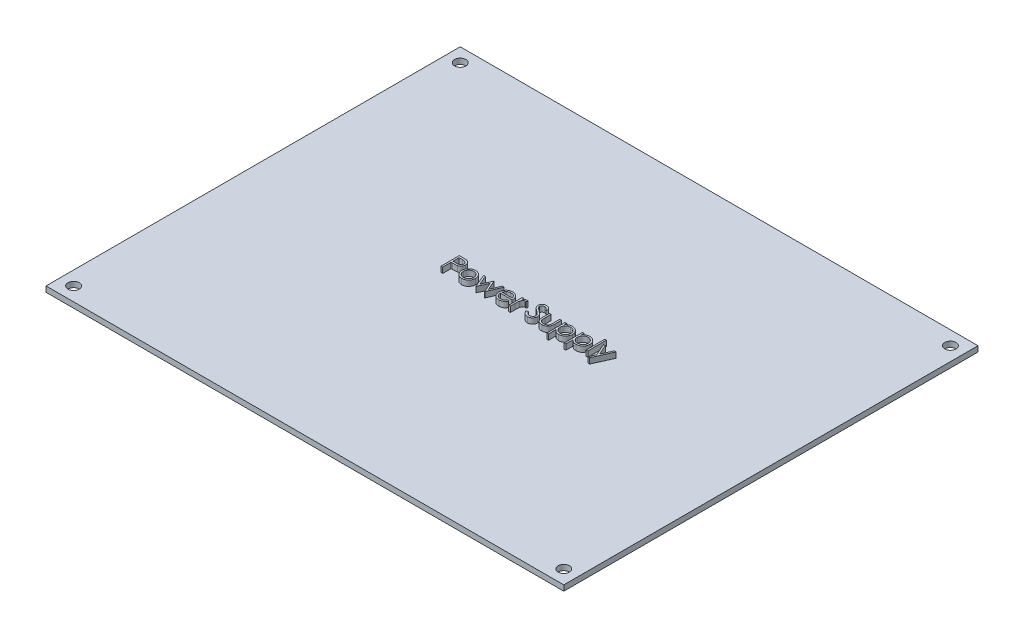
from build123d import *

# Parameters (mm, degrees)
SKETCH1_W             = 150
SKETCH1_H             = 120
BOSS_EXTRUDE1_DEPTH   = 1.6
F_4_CLEARANCE_HOLE2_D = 3.2639
SKETCH6_W             = 0.474893162
SKETCH6_H             = 5.427350427
BOSS_EXTRUDE2_DEPTH   = 1.6


with BuildPart() as part:
    # Sketch1 → Boss-Extrude1 (new body)
    with BuildSketch(Plane(origin=(0, 0, 0), x_dir=(1, 0, 0), z_dir=(0, 1, 0))):
        Rectangle(SKETCH1_W, SKETCH1_H)
    extrude(amount=BOSS_EXTRUDE1_DEPTH)

    # #4 Clearance Hole2 (through all)
    with Locations(Plane(origin=(0, 1.6, 0), x_dir=(1, 0, 0), z_dir=(0, 1, 0))):
        with Locations((-71, 56), (71, 56), (71, -56), (-71, -56)):
            Hole(F_4_CLEARANCE_HOLE2_D / 2)

    # Sketch6 → Boss-Extrude2 (add)
    # profile 1 of 11: a face of its own
    with BuildSketch(Plane(origin=(0, 1.6, 0), x_dir=(1, 0, 0), z_dir=(0, 1, 0))):
        with BuildLine():
            Line((-21.139712954, 5.867840544), (-20.101944191, 5.867840544))
            add(Edge.make_bspline(
                [(-20.101944191, 5.867840544), (-20.030565797, 5.867762082), (-19.893801625, 5.867611745), (-19.697684814, 5.863053737), (-19.51956772, 5.856965762), (-19.359834406, 5.848526471), (-19.2179934, 5.838553055), (-19.094686531, 5.824564852), (-18.988944583, 5.809959405), (-18.925586022, 5.795110374), (-18.896690785, 5.788338341)],
                knots=[0, 0, 0, 0, 1.415646017, 2.712440637, 3.8905458, 4.950247383, 5.884950622, 6.709939814, 7.411656543, 8, 8, 8, 8], degree=3))
            add(Edge.make_bspline(
                [(-18.896690785, 5.788338341), (-18.860112466, 5.778326583), (-18.787817751, 5.758538983), (-18.683645936, 5.71890633), (-18.584534765, 5.671913056), (-18.490144194, 5.618355433), (-18.40163414, 5.555935592), (-18.317684054, 5.487183812), (-18.239034798, 5.41051275), (-18.166128646, 5.326782346), (-18.09917425, 5.237398219), (-18.041525801, 5.141026038), (-17.993254874, 5.039287996), (-17.951853976, 4.932254859), (-17.92205667, 4.819027822), (-17.899609571, 4.700393626), (-17.885361944, 4.576364987), (-17.883997356, 4.491607807), (-17.883302698, 4.448461204)],
                knots=[0, 0, 0, 0, 0.999701418, 1.975846123, 2.934577507, 3.890451536, 4.834027766, 5.787354733, 6.749476667, 7.726910423, 8.712836071, 9.690891519, 10.682875813, 11.679750201, 12.712814741, 13.765529915, 14.8625177, 16, 16, 16, 16], degree=3))
            add(Edge.make_bspline(
                [(-17.883302698, 4.448461204), (-17.883939852, 4.404951946), (-17.885186487, 4.319823145), (-17.900148728, 4.195283334), (-17.920302708, 4.076268625), (-17.951292299, 3.963042908), (-17.9918804, 3.856278589), (-18.039493385, 3.754344107), (-18.096920865, 3.658973651), (-18.162907691, 3.569820985), (-18.236313078, 3.486802427), (-18.316826448, 3.410519583), (-18.40412276, 3.341418976), (-18.497924579, 3.279345695), (-18.599146374, 3.225739177), (-18.706252963, 3.177725156), (-18.820175314, 3.137401053), (-18.89900983, 3.116188936), (-18.939091961, 3.105403979)],
                knots=[0, 0, 0, 0, 1.121902311, 2.195077645, 3.232258892, 4.234102512, 5.217864754, 6.176164875, 7.132989551, 8.084763148, 9.034132444, 9.988522005, 10.94243251, 11.903244335, 12.886203696, 13.894208494, 14.929344452, 16, 16, 16, 16], degree=3))
            add(Edge.make_bspline(
                [(-18.939091961, 3.105403979), (-18.972244001, 3.098353996), (-19.044898626, 3.082903548), (-19.164554885, 3.065655047), (-19.303869932, 3.050932722), (-19.462653617, 3.039894098), (-19.640763414, 3.030444136), (-19.838295672, 3.022932851), (-20.055638146, 3.018805572), (-20.207238717, 3.018592707), (-20.286389303, 3.01848157)],
                knots=[0, 0, 0, 0, 0.601384939, 1.31797006, 2.144135048, 3.087295005, 4.142315834, 5.309527816, 6.595305764, 8, 8, 8, 8], degree=3))
            Line((-20.286389303, 3.01848157), (-20.664819792, 3.01848157))
            Line((-20.664819792, 3.01848157), (-20.664819792, 0.576173878))
            Line((-20.664819792, 0.576173878), (-21.139712954, 0.576173878))
            Line((-21.139712954, 0.576173878), (-21.139712954, 5.867840544))
        make_face()
        with BuildLine():
            Line((-20.664819792, 5.325105502), (-20.664819792, 3.561216613))
            Line((-20.664819792, 3.561216613), (-19.738354113, 3.54955629))
            add(Edge.make_bspline(
                [(-19.738354113, 3.54955629), (-19.693118035, 3.54953291), (-19.605790718, 3.549487776), (-19.479643095, 3.555513055), (-19.362607625, 3.562468622), (-19.255043803, 3.572652697), (-19.15690314, 3.587047931), (-19.068021995, 3.601579964), (-18.989089556, 3.622603548), (-18.896713381, 3.650911045), (-18.793777844, 3.699190119), (-18.681794765, 3.769266738), (-18.586891616, 3.858591142), (-18.504767525, 3.959023697), (-18.439595543, 4.070752142), (-18.391885888, 4.190296844), (-18.363853424, 4.316431807), (-18.360094536, 4.402743636), (-18.35819586, 4.446341145)],
                knots=[0, 0, 0, 0, 1.160613943, 2.240541288, 3.23993089, 4.169200891, 5.011653406, 5.7853311, 6.478053781, 7.106038997, 8.262395093, 9.384106736, 10.481365981, 11.59014053, 12.70357646, 13.786202915, 14.881775077, 16, 16, 16, 16], degree=3))
            add(Edge.make_bspline(
                [(-18.35819586, 4.446341145), (-18.360104861, 4.488883898), (-18.36389972, 4.573453624), (-18.392105608, 4.697397703), (-18.439502785, 4.815682637), (-18.505205017, 4.926010992), (-18.584944583, 5.02608216), (-18.677623351, 5.11301234), (-18.783023163, 5.182895153), (-18.881067512, 5.228000233), (-18.96815502, 5.255539995), (-19.043798578, 5.27480898), (-19.129207098, 5.290193527), (-19.224408384, 5.302650871), (-19.328664549, 5.313315033), (-19.442871287, 5.320550974), (-19.566595962, 5.324786509), (-19.652488135, 5.324996597), (-19.697012968, 5.325105502)],
                knots=[0, 0, 0, 0, 1.120700087, 2.227813068, 3.331159281, 4.466773991, 5.599788987, 6.693661531, 7.80175334, 8.91857717, 9.525282508, 10.207424825, 10.974604443, 11.810962634, 12.737642355, 13.736264703, 14.826523623, 16, 16, 16, 16], degree=3))
            Line((-19.697012968, 5.325105502), (-20.664819792, 5.325105502))
        make_face(mode=Mode.SUBTRACT)
    # profile 2 of 11: a face of its own
    with BuildSketch(Plane(origin=(0, 1.6, 0), x_dir=(1, 0, 0), z_dir=(0, 1, 0))):
        with BuildLine():
            add(Edge.make_bspline(
                [(-15.065744605, 4.511002937), (-14.993186371, 4.509457935), (-14.850917406, 4.506428564), (-14.642565008, 4.474051175), (-14.44368129, 4.424540279), (-14.253504547, 4.356093989), (-14.074470386, 4.264348659), (-13.903971005, 4.154872707), (-13.742473861, 4.025177595), (-13.645677138, 3.924850516), (-13.596543884, 3.87392528)],
                knots=[0, 0, 0, 0, 1.054011418, 2.066658804, 3.057071809, 4.030435133, 4.997543892, 5.974964718, 6.972108034, 8, 8, 8, 8], degree=3))
            add(Edge.make_bspline(
                [(-13.596543884, 3.87392528), (-13.554237834, 3.825220801), (-13.470444473, 3.72875441), (-13.362999875, 3.572339376), (-13.270438706, 3.410353748), (-13.196260182, 3.24064648), (-13.137772111, 3.064699061), (-13.096246594, 2.881906734), (-13.071546704, 2.692673186), (-13.068216028, 2.564155478), (-13.066529193, 2.499067174)],
                knots=[0, 0, 0, 0, 1.025258237, 2.030674902, 3.01204498, 3.988269485, 4.97094183, 5.956517959, 6.965070386, 8, 8, 8, 8], degree=3))
            add(Edge.make_bspline(
                [(-13.066529193, 2.499067174), (-13.068012882, 2.43360161), (-13.07094472, 2.304238604), (-13.098678521, 2.113709325), (-13.141814805, 1.92896239), (-13.203548656, 1.75077127), (-13.282709131, 1.578591281), (-13.379305765, 1.413174462), (-13.494016425, 1.254194451), (-13.624046277, 1.103001196), (-13.767755661, 0.963654657), (-13.923657457, 0.842205964), (-14.08868796, 0.738154373), (-14.265041601, 0.654339792), (-14.451107921, 0.588254888), (-14.64728825, 0.541839387), (-14.853277821, 0.513775889), (-14.99392612, 0.510172154), (-15.065744605, 0.508331997)],
                knots=[0, 0, 0, 0, 0.998656419, 1.973391657, 2.932242238, 3.890759089, 4.846373663, 5.82037756, 6.809684879, 7.83454468, 8.860553229, 9.859544525, 10.845671541, 11.83227036, 12.833544569, 13.85385346, 14.904124723, 16, 16, 16, 16], degree=3))
            add(Edge.make_bspline(
                [(-15.065744605, 0.508331997), (-15.137914955, 0.51017833), (-15.279264231, 0.513794465), (-15.485980894, 0.541730357), (-15.682512818, 0.588233497), (-15.868822722, 0.654556968), (-16.045934574, 0.738157052), (-16.211921302, 0.841891392), (-16.367949746, 0.963690675), (-16.511689532, 1.102991437), (-16.641711233, 1.254196966), (-16.756423995, 1.41317381), (-16.853020083, 1.578591451), (-16.932180701, 1.750771225), (-16.993914514, 1.928962403), (-17.037050809, 2.113709321), (-17.064784607, 2.304238605), (-17.067716445, 2.433601611), (-17.069200134, 2.499067174)],
                knots=[0, 0, 0, 0, 1.099876186, 2.154163076, 3.173186993, 4.173200201, 5.163417411, 6.152872554, 7.150605724, 8.17532212, 9.198891216, 10.186952605, 11.159729845, 12.11414092, 13.071450619, 14.029093627, 15.002601286, 16, 16, 16, 16], degree=3))
            add(Edge.make_bspline(
                [(-17.069200134, 2.499067174), (-17.067501795, 2.563801713), (-17.064139377, 2.691964976), (-17.039464322, 2.880842794), (-16.99810079, 3.063325752), (-16.939542608, 3.238594031), (-16.864680355, 3.407557607), (-16.773419836, 3.569943482), (-16.664879237, 3.725651228), (-16.581419143, 3.821992944), (-16.539185443, 3.870745192)],
                knots=[0, 0, 0, 0, 1.031353054, 2.041901799, 3.029428768, 4.008703097, 4.981709435, 5.96992636, 6.972712378, 8, 8, 8, 8], degree=3))
            add(Edge.make_bspline(
                [(-16.539185443, 3.870745192), (-16.490126264, 3.922112064), (-16.393642756, 4.023134057), (-16.231341703, 4.152451088), (-16.061261759, 4.264205152), (-15.880249073, 4.354127525), (-15.690228562, 4.424942903), (-15.49032566, 4.474178861), (-15.281266249, 4.506311909), (-15.138301108, 4.509423678), (-15.065744605, 4.511002937)],
                knots=[0, 0, 0, 0, 1.027980169, 2.021703884, 2.998553061, 3.971491411, 4.943284454, 5.930300938, 6.949603206, 8, 8, 8, 8], degree=3))
        make_face()
        with BuildLine():
            add(Edge.make_bspline(
                [(-15.067864664, 4.036109775), (-15.1191751, 4.034651404), (-15.220471401, 4.03177231), (-15.369574821, 4.009874026), (-15.513115292, 3.975179585), (-15.65136514, 3.925885357), (-15.78385815, 3.862235832), (-15.910721175, 3.784057716), (-16.032327364, 3.69238646), (-16.146297865, 3.587365516), (-16.250894932, 3.472643703), (-16.342331873, 3.350408684), (-16.420081736, 3.222643137), (-16.484851976, 3.089214198), (-16.533092606, 2.948769716), (-16.568128009, 2.80290019), (-16.590005635, 2.651308429), (-16.592857659, 2.548255461), (-16.594306971, 2.495887085)],
                knots=[0, 0, 0, 0, 1.021534396, 2.016698045, 2.994645724, 3.958388632, 4.93408049, 5.916473867, 6.921342795, 7.962252576, 8.998418191, 10.008913653, 10.997312074, 11.973003931, 12.956656626, 13.948281152, 14.957379055, 16, 16, 16, 16], degree=3))
            add(Edge.make_bspline(
                [(-16.594306971, 2.495887085), (-16.591877607, 2.428226282), (-16.587055773, 2.293932241), (-16.547844166, 2.096158282), (-16.482248242, 1.906290481), (-16.393669855, 1.725441898), (-16.282686644, 1.558115954), (-16.151926436, 1.408934066), (-16.002792603, 1.280141233), (-15.837062894, 1.173278526), (-15.658122438, 1.088370323), (-15.468746809, 1.028198063), (-15.271230522, 0.989082528), (-15.136246559, 0.985194703), (-15.067864664, 0.98322516)],
                knots=[0, 0, 0, 0, 1.016792936, 2.018143844, 3.017858371, 4.030088057, 5.03801393, 6.028138512, 7.003788237, 7.991172063, 8.984598303, 9.972568034, 10.972917682, 12, 12, 12, 12], degree=3))
            add(Edge.make_bspline(
                [(-15.067864664, 0.98322516), (-14.999486701, 0.985206179), (-14.864510502, 0.989116655), (-14.667268652, 1.028001061), (-14.478410623, 1.088633977), (-14.299656025, 1.173183032), (-14.134001755, 1.28054704), (-13.983795346, 1.408206801), (-13.854151612, 1.558511076), (-13.743278186, 1.72566353), (-13.653249182, 1.90601011), (-13.587960294, 2.096193324), (-13.54865442, 2.293923316), (-13.54384531, 2.428223293), (-13.541422356, 2.495887085)],
                knots=[0, 0, 0, 0, 1.02726834, 2.027799167, 3.010890988, 4.004497153, 4.992059811, 5.971914811, 6.958719428, 7.966827853, 8.981595046, 9.981490638, 10.983022906, 12, 12, 12, 12], degree=3))
            add(Edge.make_bspline(
                [(-13.541422356, 2.495887085), (-13.542871169, 2.548255774), (-13.545722212, 2.651309358), (-13.567606979, 2.802896639), (-13.60261595, 2.948782743), (-13.65095399, 3.089166129), (-13.715442797, 3.222988606), (-13.794691996, 3.350033551), (-13.88575557, 3.473067138), (-13.991614789, 3.586994666), (-14.105466324, 3.6924274), (-14.227121799, 3.784093263), (-14.353796707, 3.861892246), (-14.485904802, 3.926429777), (-14.624172375, 3.974731113), (-14.767511725, 4.010074353), (-14.915978973, 4.03167977), (-15.016912288, 4.034623662), (-15.067864664, 4.036109775)],
                knots=[0, 0, 0, 0, 1.042956736, 2.052379634, 3.044323526, 4.02829302, 5.004299113, 5.996692471, 7.007513377, 8.048758398, 9.090003419, 10.095195979, 11.07790575, 12.047570684, 13.018257071, 13.989683339, 14.985167495, 16, 16, 16, 16], degree=3))
        make_face(mode=Mode.SUBTRACT)
    # profile 3 of 11: a face of its own
    with BuildSketch(Plane(origin=(0, 1.6, 0), x_dir=(1, 0, 0), z_dir=(0, 1, 0))):
        Polygon((-12.659477911, 4.443161057), (-12.14960378, 4.443161057), (-10.997351843, 1.661643963), (-9.734856851, 4.443161057), (-9.654294618, 4.443161057), (-8.41936039, 1.661643963), (-7.25650816, 4.443161057), (-6.757234322, 4.443161057), (-8.373779127, 0.576173878), (-8.472361859, 0.576173878), (-9.708356117, 3.357690972), (-10.969791079, 0.576173878), (-11.057773518, 0.576173878), align=None)
    # profile 4 of 11: a face of its own
    with BuildSketch(Plane(origin=(0, 1.6, 0), x_dir=(1, 0, 0), z_dir=(0, 1, 0))):
        with BuildLine():
            Line((-2.972929434, 1.797327724), (-2.551037741, 1.575781583))
            add(Edge.make_bspline(
                [(-2.551037741, 1.575781583), (-2.584657355, 1.516147023), (-2.65006781, 1.400121784), (-2.762554655, 1.240718852), (-2.880471241, 1.097318139), (-3.009140336, 0.973750686), (-3.14471235, 0.866025377), (-3.287939102, 0.771776523), (-3.439566243, 0.691466379), (-3.599600946, 0.623804819), (-3.769387173, 0.571780941), (-3.94933637, 0.535035274), (-4.139793274, 0.512321523), (-4.270340474, 0.509683036), (-4.337187246, 0.508331997)],
                knots=[0, 0, 0, 0, 1.120438281, 2.179929193, 3.190490725, 4.156257408, 5.095198341, 6.022838206, 6.959905092, 7.901321166, 8.864066838, 9.862729781, 10.905609505, 12, 12, 12, 12], degree=3))
            add(Edge.make_bspline(
                [(-4.337187246, 0.508331997), (-4.411485236, 0.510066417), (-4.55641909, 0.513449768), (-4.767389898, 0.542618137), (-4.966023067, 0.590201346), (-5.152307428, 0.656673057), (-5.325786786, 0.743497702), (-5.486805935, 0.849269776), (-5.636211647, 0.973445923), (-5.769295868, 1.117101736), (-5.889105072, 1.270835171), (-5.994826252, 1.431030378), (-6.08320832, 1.5972843), (-6.155103338, 1.768538545), (-6.213167836, 1.943713717), (-6.253636543, 2.124403674), (-6.276964853, 2.310119379), (-6.280539669, 2.435754637), (-6.282341159, 2.499067174)],
                knots=[0, 0, 0, 0, 1.145258523, 2.234067595, 3.276747158, 4.290159414, 5.277019952, 6.260822364, 7.254936242, 8.264827045, 9.274100331, 10.257902744, 11.220704747, 12.172965371, 13.118907548, 14.062713208, 15.023725156, 16, 16, 16, 16], degree=3))
            add(Edge.make_bspline(
                [(-6.282341159, 2.499067174), (-6.280739838, 2.558477215), (-6.277566232, 2.676220071), (-6.257562542, 2.850490597), (-6.222110956, 3.019866947), (-6.173463418, 3.184489863), (-6.110641891, 3.344083708), (-6.033788417, 3.498745614), (-5.942783274, 3.648311004), (-5.872521018, 3.742658599), (-5.83712882, 3.790182959)],
                knots=[0, 0, 0, 0, 1.024358464, 2.0301432, 3.019427413, 4.004406732, 4.986367066, 5.972626655, 6.978780325, 8, 8, 8, 8], degree=3))
            add(Edge.make_bspline(
                [(-5.83712882, 3.790182959), (-5.789189823, 3.847437084), (-5.694830416, 3.960131668), (-5.535239259, 4.10820509), (-5.362428248, 4.232247464), (-5.178563052, 4.335067777), (-4.981506716, 4.41319341), (-4.773908145, 4.471413207), (-4.553403508, 4.504037104), (-4.40265871, 4.508645139), (-4.325526923, 4.511002937)],
                knots=[0, 0, 0, 0, 1.030682036, 2.02871468, 2.997146059, 3.962720338, 4.930598197, 5.918074684, 6.934738563, 8, 8, 8, 8], degree=3))
            add(Edge.make_bspline(
                [(-4.325526923, 4.511002937), (-4.246231139, 4.508955745), (-4.090670886, 4.504939619), (-3.863836608, 4.467706948), (-3.649205525, 4.408663205), (-3.446863524, 4.325275926), (-3.256790092, 4.217689461), (-3.080220707, 4.084427391), (-2.914135682, 3.929580997), (-2.817511998, 3.810498526), (-2.768343763, 3.749901842)],
                knots=[0, 0, 0, 0, 1.056321875, 2.072262726, 3.055038591, 4.01806755, 4.982017516, 5.957941055, 6.960871419, 8, 8, 8, 8], degree=3))
            add(Edge.make_bspline(
                [(-2.768343763, 3.749901842), (-2.73488994, 3.704236904), (-2.668204972, 3.613210986), (-2.584676618, 3.464785546), (-2.512169604, 3.30949691), (-2.454213818, 3.144834913), (-2.407285049, 2.972750548), (-2.373332477, 2.792013605), (-2.353421268, 2.602677906), (-2.349507404, 2.47367228), (-2.347512099, 2.407904647)],
                knots=[0, 0, 0, 0, 0.94817472, 1.890038105, 2.849395472, 3.817997239, 4.812318967, 5.836947057, 6.897266129, 8, 8, 8, 8], degree=3))
            Line((-2.347512099, 2.407904647), (-5.807447997, 2.407904647))
            add(Edge.make_bspline(
                [(-5.807447997, 2.407904647), (-5.805120259, 2.356952755), (-5.800542855, 2.256757913), (-5.779202103, 2.110147324), (-5.745564076, 1.970487629), (-5.698288231, 1.838826363), (-5.641037168, 1.713443908), (-5.570906382, 1.595270352), (-5.487238246, 1.484843958), (-5.393914868, 1.381176976), (-5.290036283, 1.28885892), (-5.180751653, 1.20623064), (-5.064495906, 1.13697694), (-4.942185708, 1.080764488), (-4.814018843, 1.03675851), (-4.679954929, 1.006720257), (-4.540257777, 0.986601179), (-4.445029345, 0.984364066), (-4.396548892, 0.98322516)],
                knots=[0, 0, 0, 0, 1.094153842, 2.151609401, 3.174256925, 4.172055639, 5.149267565, 6.128595816, 7.11444997, 8.118368179, 9.117203808, 10.09244225, 11.054858984, 12.015122123, 12.976791628, 13.957293641, 14.960065497, 16, 16, 16, 16], degree=3))
            add(Edge.make_bspline(
                [(-4.396548892, 0.98322516), (-4.349148942, 0.984144483), (-4.25509835, 0.985968598), (-4.115034197, 1.00370613), (-3.977239911, 1.03238738), (-3.842285806, 1.071530579), (-3.712910836, 1.119271773), (-3.593099112, 1.176879664), (-3.482911167, 1.240606067), (-3.3799248, 1.313494505), (-3.280031751, 1.402709263), (-3.180937754, 1.514039461), (-3.074686147, 1.645707509), (-3.008178072, 1.744806313), (-2.972929434, 1.797327724)],
                knots=[0, 0, 0, 0, 0.99110716, 1.966546729, 2.947904876, 3.932708344, 4.903319531, 5.828989031, 6.710028674, 7.56322171, 8.463672341, 9.504779593, 10.677557249, 12, 12, 12, 12], degree=3))
        make_face()
        with BuildLine():
            add(Edge.make_bspline(
                [(-2.822405262, 2.882797809), (-2.839787063, 2.945788106), (-2.873241436, 3.067024152), (-2.943146415, 3.234907403), (-3.021873626, 3.38411411), (-3.115039815, 3.513502365), (-3.220599079, 3.628412438), (-3.342526914, 3.728831014), (-3.479257372, 3.818664541), (-3.630083692, 3.894490343), (-3.78980401, 3.959033344), (-3.957030038, 4.002311793), (-4.127660265, 4.031959553), (-4.243070436, 4.034720455), (-4.301146247, 4.036109775)],
                knots=[0, 0, 0, 0, 1.154881502, 2.222775134, 3.210006277, 4.132804581, 5.035138423, 5.962687519, 6.919655026, 7.923214229, 8.944639381, 9.960483929, 10.97369054, 12, 12, 12, 12], degree=3))
            add(Edge.make_bspline(
                [(-4.301146247, 4.036109775), (-4.348543613, 4.035184986), (-4.442238239, 4.033356872), (-4.580276759, 4.016015129), (-4.712840113, 3.987349649), (-4.840906441, 3.948093108), (-4.962797516, 3.895768197), (-5.081020558, 3.834410223), (-5.192569491, 3.759508067), (-5.262330735, 3.702420275), (-5.297573865, 3.673579727)],
                knots=[0, 0, 0, 0, 1.04873581, 2.073130211, 3.073294108, 4.04793562, 5.032784715, 6.005352987, 6.992311501, 8, 8, 8, 8], degree=3))
            add(Edge.make_bspline(
                [(-5.297573865, 3.673579727), (-5.322812517, 3.650758559), (-5.373889399, 3.604574078), (-5.442137568, 3.52500373), (-5.507482807, 3.439200773), (-5.566951544, 3.343882549), (-5.621497419, 3.240134466), (-5.672539289, 3.128831613), (-5.71848065, 3.00912938), (-5.74432834, 2.925713907), (-5.757626616, 2.882797809)],
                knots=[0, 0, 0, 0, 0.879870761, 1.780643979, 2.707998968, 3.669668524, 4.684282772, 5.740141944, 6.837334558, 8, 8, 8, 8], degree=3))
            Line((-5.757626616, 2.882797809), (-2.822405262, 2.882797809))
        make_face(mode=Mode.SUBTRACT)
    # profile 5 of 11: a face of its own
    with BuildSketch(Plane(origin=(0, 1.6, 0), x_dir=(1, 0, 0), z_dir=(0, 1, 0))):
        with BuildLine():
            Line((-1.533409535, 4.443161057), (-1.058516373, 4.443161057))
            Line((-1.058516373, 4.443161057), (-1.058516373, 3.87392528))
            add(Edge.make_bspline(
                [(-1.058516373, 3.87392528), (-1.023457178, 3.926926354), (-0.956406741, 4.028290495), (-0.844959812, 4.162350034), (-0.730805966, 4.273346592), (-0.613398718, 4.361798341), (-0.491874686, 4.428039604), (-0.368900961, 4.476561217), (-0.242542811, 4.50525311), (-0.15763133, 4.509083761), (-0.115090224, 4.511002937)],
                knots=[0, 0, 0, 0, 1.2804753, 2.448899062, 3.506932113, 4.484331642, 5.4025378, 6.288909075, 7.142734305, 8, 8, 8, 8], degree=3))
            add(Edge.make_bspline(
                [(-0.115090224, 4.511002937), (-0.082090898, 4.509202975), (-0.014192638, 4.505499434), (0.088590563, 4.479478306), (0.194489592, 4.437934153), (0.262740582, 4.398866198), (0.298321234, 4.378499265)],
                knots=[0, 0, 0, 0, 0.901110191, 1.854092781, 2.881294221, 4, 4, 4, 4], degree=3))
            Line((0.298321234, 4.378499265), (0.037554006, 3.967207865))
            add(Edge.make_bspline(
                [(0.037554006, 3.967207865), (0.014710605, 3.977398506), (-0.028650543, 3.996742292), (-0.092081851, 4.019635569), (-0.150564349, 4.033115585), (-0.187823062, 4.035157741), (-0.205192722, 4.036109775)],
                knots=[0, 0, 0, 0, 1.180555205, 2.24091978, 3.179933427, 4, 4, 4, 4], degree=3))
            add(Edge.make_bspline(
                [(-0.205192722, 4.036109775), (-0.24330139, 4.033569719), (-0.321032028, 4.02838874), (-0.435157402, 3.987659828), (-0.5459002, 3.92185381), (-0.633850214, 3.848872486), (-0.70194981, 3.77849665), (-0.75054277, 3.717040136), (-0.795117876, 3.648129586), (-0.837708566, 3.57294304), (-0.876513559, 3.490196726), (-0.912730737, 3.400717343), (-0.945476875, 3.304401256), (-0.964149268, 3.237299112), (-0.973714023, 3.202926682)],
                knots=[0, 0, 0, 0, 1.125678352, 2.296057538, 3.5422874, 4.923748041, 5.663163013, 6.437101912, 7.23742474, 8.08941207, 8.991984279, 9.93940061, 10.944477711, 12, 12, 12, 12], degree=3))
            add(Edge.make_bspline(
                [(-0.973714023, 3.202926682), (-0.980868951, 3.172269527), (-0.996716573, 3.104366257), (-1.012125207, 2.990446464), (-1.027349359, 2.855851171), (-1.03807877, 2.700205727), (-1.048024144, 2.523898817), (-1.053633435, 2.326661852), (-1.058325088, 2.108292381), (-1.058450677, 1.955628775), (-1.058516373, 1.875769898)],
                knots=[0, 0, 0, 0, 0.566838948, 1.255505196, 2.06880316, 3.007127437, 4.065329342, 5.249902469, 6.561414163, 8, 8, 8, 8], degree=3))
            Line((-1.058516373, 1.875769898), (-1.058516373, 0.576173878))
            Line((-1.058516373, 0.576173878), (-1.533409535, 0.576173878))
            Line((-1.533409535, 0.576173878), (-1.533409535, 4.443161057))
        make_face()
    # profile 6 of 11: a face of its own
    with BuildSketch(Plane(origin=(0, 1.6, 0), x_dir=(1, 0, 0), z_dir=(0, 1, 0))):
        with BuildLine():
            Line((2.401419524, 1.596982171), (2.848751923, 1.865169604))
            add(Edge.make_bspline(
                [(2.848751923, 1.865169604), (2.890356877, 1.795524641), (2.970070363, 1.66208758), (3.103044442, 1.481780781), (3.240828724, 1.328530853), (3.38444355, 1.203229316), (3.533012305, 1.104579213), (3.687504862, 1.034725839), (3.8474006, 0.991158828), (3.956218163, 0.985867031), (4.010544124, 0.98322516)],
                knots=[0, 0, 0, 0, 1.272034388, 2.437168799, 3.508375237, 4.49857839, 5.41946034, 6.295179144, 7.148887113, 8, 8, 8, 8], degree=3))
            add(Edge.make_bspline(
                [(4.010544124, 0.98322516), (4.056939734, 0.984517343), (4.148919141, 0.9870791), (4.284328723, 1.011694122), (4.415836924, 1.049510079), (4.540733317, 1.103667916), (4.657294543, 1.169191579), (4.759509428, 1.248334014), (4.847874385, 1.336941015), (4.920157213, 1.435793362), (4.975613933, 1.542106194), (5.018237655, 1.651229358), (5.041891517, 1.764877075), (5.045454703, 1.841395275), (5.047252858, 1.880010015)],
                knots=[0, 0, 0, 0, 1.095163259, 2.171163733, 3.241058638, 4.321873601, 5.38011039, 6.391990106, 7.366004449, 8.327778327, 9.272591725, 10.192022065, 11.087607919, 12, 12, 12, 12], degree=3))
            add(Edge.make_bspline(
                [(5.047252858, 1.880010015), (5.04502384, 1.924068205), (5.040492574, 2.013632066), (5.002193788, 2.145772017), (4.941945522, 2.276540546), (4.886363906, 2.357429364), (4.857507599, 2.399424412)],
                knots=[0, 0, 0, 0, 0.938893495, 1.908633276, 2.914225137, 4, 4, 4, 4], degree=3))
            add(Edge.make_bspline(
                [(4.857507599, 2.399424412), (4.833815123, 2.4297333), (4.784075732, 2.493363019), (4.69856616, 2.588076649), (4.598226915, 2.685773544), (4.486491779, 2.790184261), (4.359290561, 2.896452716), (4.220607295, 3.009646422), (4.066901223, 3.125460711), (3.959103174, 3.203131137), (3.903481156, 3.243207799)],
                knots=[0, 0, 0, 0, 0.722233717, 1.516239348, 2.393582979, 3.351407094, 4.387010283, 5.505090956, 6.712668013, 8, 8, 8, 8], degree=3))
            add(Edge.make_bspline(
                [(3.903481156, 3.243207799), (3.847806781, 3.282862925), (3.741361615, 3.358680507), (3.592501616, 3.471202937), (3.459386773, 3.574078787), (3.342608736, 3.66827652), (3.24221887, 3.75380891), (3.157426093, 3.829854604), (3.090390418, 3.898470226), (3.053113528, 3.94298273), (3.036377123, 3.962967748)],
                knots=[0, 0, 0, 0, 1.452282411, 2.77665338, 3.964542531, 5.026858415, 5.96415736, 6.766646006, 7.446254459, 8, 8, 8, 8], degree=3))
            add(Edge.make_bspline(
                [(3.036377123, 3.962967748), (3.012984108, 3.994114554), (2.966978605, 4.055368927), (2.90625143, 4.151110081), (2.854636268, 4.249116685), (2.81417417, 4.349652099), (2.780101554, 4.451304908), (2.757184206, 4.555401434), (2.742834118, 4.661474584), (2.741364567, 4.7328569), (2.740628926, 4.768590077)],
                knots=[0, 0, 0, 0, 1.068054152, 2.10047183, 3.106115577, 4.101338837, 5.06977816, 6.043150881, 7.020423561, 8, 8, 8, 8], degree=3))
            add(Edge.make_bspline(
                [(2.740628926, 4.768590077), (2.742602278, 4.824575569), (2.746506802, 4.935349904), (2.779527584, 5.097170326), (2.831647316, 5.251666457), (2.904664587, 5.397308747), (2.998791776, 5.530304933), (3.107718427, 5.652184847), (3.237457222, 5.75464449), (3.379807021, 5.844167483), (3.535618441, 5.914238108), (3.698890402, 5.96709578), (3.869882404, 5.997045491), (3.985699048, 6.001343481), (4.044465064, 6.003524305)],
                knots=[0, 0, 0, 0, 1.005424448, 1.989358655, 2.955360095, 3.929531133, 4.905563448, 5.876582895, 6.856512386, 7.866279853, 8.892233794, 9.918561126, 10.94386622, 12, 12, 12, 12], degree=3))
            add(Edge.make_bspline(
                [(4.044465064, 6.003524305), (4.106822216, 6.001373542), (4.230830688, 5.997096362), (4.413240811, 5.959907238), (4.588864752, 5.898371698), (4.730142069, 5.828538846), (4.840711839, 5.758792539), (4.925034899, 5.695262567), (5.010483902, 5.62212401), (5.097748104, 5.539182054), (5.185348863, 5.445675657), (5.274586702, 5.34224521), (5.365670298, 5.229522798), (5.424265468, 5.149052422), (5.45430414, 5.107799479)],
                knots=[0, 0, 0, 0, 1.286793592, 2.559021753, 3.825965368, 5.121522368, 5.803751409, 6.523245864, 7.299691795, 8.125521123, 9.008227632, 9.944561021, 10.946284179, 12, 12, 12, 12], degree=3))
            Line((5.45430414, 5.107799479), (5.024992241, 4.782370459))
            add(Edge.make_bspline(
                [(5.024992241, 4.782370459), (4.999069224, 4.815766455), (4.949147554, 4.880079336), (4.873356544, 4.970145491), (4.801921089, 5.052418026), (4.731541317, 5.123878398), (4.665934279, 5.188439957), (4.602257323, 5.243714827), (4.541426815, 5.290244596), (4.464747677, 5.339900931), (4.368412555, 5.389123264), (4.247483554, 5.430774846), (4.121109066, 5.455804523), (4.035036886, 5.459113913), (3.991463595, 5.460789262)],
                knots=[0, 0, 0, 0, 1.181633172, 2.275549214, 3.290209073, 4.226197932, 5.078386478, 5.862611352, 6.581680152, 7.217281963, 8.414376989, 9.595101626, 10.782541182, 12, 12, 12, 12], degree=3))
            add(Edge.make_bspline(
                [(3.991463595, 5.460789262), (3.936798377, 5.458957287), (3.831381652, 5.455424496), (3.681717843, 5.416840709), (3.547016314, 5.356089563), (3.431276126, 5.27094668), (3.334911887, 5.170070893), (3.265204824, 5.053988576), (3.223249218, 4.925805658), (3.218129486, 4.836389106), (3.215522089, 4.790850694)],
                knots=[0, 0, 0, 0, 1.14458467, 2.207223713, 3.21896685, 4.227309161, 5.202851033, 6.127160689, 7.046193047, 8, 8, 8, 8], degree=3))
            add(Edge.make_bspline(
                [(3.215522089, 4.790850694), (3.216116459, 4.762500244), (3.217306171, 4.705752986), (3.233899019, 4.621915717), (3.255215862, 4.53829024), (3.288995793, 4.455252525), (3.335630955, 4.37135034), (3.396870923, 4.285138903), (3.473998193, 4.195858344), (3.533078914, 4.137790052), (3.564271755, 4.107131744)],
                knots=[0, 0, 0, 0, 0.858281714, 1.717966888, 2.583508476, 3.4729293, 4.427298488, 5.488583878, 6.674047936, 8, 8, 8, 8], degree=3))
            add(Edge.make_bspline(
                [(3.564271755, 4.107131744), (3.57585502, 4.096794812), (3.603374207, 4.072236628), (3.653684238, 4.032031632), (3.720121564, 3.982436964), (3.80095132, 3.921072807), (3.897663879, 3.84989012), (4.010269875, 3.769799064), (4.137514097, 3.67819962), (4.227807946, 3.614159053), (4.275551469, 3.580297142)],
                knots=[0, 0, 0, 0, 0.420754252, 0.999615792, 1.744751191, 2.668019286, 3.750313428, 4.999500688, 6.413464383, 8, 8, 8, 8], degree=3))
            add(Edge.make_bspline(
                [(4.275551469, 3.580297142), (4.332982552, 3.538506038), (4.444189885, 3.457583359), (4.602422178, 3.33600251), (4.745892579, 3.217094574), (4.875104803, 3.101618906), (4.991335367, 2.990451432), (5.093294778, 2.882254719), (5.182021938, 2.777803913), (5.277542899, 2.643890614), (5.375148174, 2.479423974), (5.458970453, 2.277919971), (5.511824145, 2.075632677), (5.518735841, 1.939671865), (5.52214602, 1.87258981)],
                knots=[0, 0, 0, 0, 1.163667725, 2.253281268, 3.268753668, 4.215851969, 5.092017293, 5.902905408, 6.650798638, 7.335211899, 8.59617414, 9.77448103, 10.901945474, 12, 12, 12, 12], degree=3))
            add(Edge.make_bspline(
                [(5.52214602, 1.87258981), (5.52115249, 1.82514871), (5.519184723, 1.731187785), (5.496565246, 1.5932188), (5.4634248, 1.459217366), (5.413475649, 1.330839851), (5.352510874, 1.20573765), (5.27515238, 1.087192372), (5.185484809, 0.972580317), (5.082624236, 0.864957657), (4.970069122, 0.766160432), (4.851106869, 0.678274828), (4.725542766, 0.604995339), (4.594057978, 0.545198232), (4.456622302, 0.4984297), (4.313281962, 0.464543576), (4.163800677, 0.443746251), (4.062199949, 0.441587612), (4.010544124, 0.440490117)],
                knots=[0, 0, 0, 0, 0.983748083, 1.948392443, 2.894712957, 3.844097841, 4.80183111, 5.778335162, 6.776009319, 7.81870978, 8.863265674, 9.881300176, 10.883814829, 11.87499822, 12.874611388, 13.892143829, 14.928324115, 16, 16, 16, 16], degree=3))
            add(Edge.make_bspline(
                [(4.010544124, 0.440490117), (3.970576403, 0.441262975), (3.891144313, 0.442798957), (3.773654978, 0.456377798), (3.65853917, 0.475589728), (3.547241387, 0.506091001), (3.438327681, 0.543097859), (3.332271743, 0.588664148), (3.229022173, 0.643269916), (3.128000352, 0.705704061), (3.029463207, 0.778362794), (2.934334964, 0.862989389), (2.839494409, 0.957249855), (2.747740846, 1.063703921), (2.657218354, 1.180631737), (2.569711711, 1.309127288), (2.48340959, 1.448490668), (2.429260014, 1.5465605), (2.401419524, 1.596982171)],
                knots=[0, 0, 0, 0, 0.915332311, 1.819136955, 2.706846663, 3.586547465, 4.459518054, 5.340707479, 6.227863349, 7.133153174, 8.059268498, 9.028702269, 10.047606654, 11.120612155, 12.245963614, 13.433783089, 14.680604001, 16, 16, 16, 16], degree=3))
        make_face()
    # profile 7 of 11: a face of its own
    with BuildSketch(Plane(origin=(0, 1.6, 0), x_dir=(1, 0, 0), z_dir=(0, 1, 0))):
        with BuildLine():
            Line((6.404090465, 4.443161057), (6.878983627, 4.443161057))
            Line((6.878983627, 4.443161057), (6.878983627, 2.649591346))
            add(Edge.make_bspline(
                [(6.878983627, 2.649591346), (6.879198174, 2.596942665), (6.879608591, 2.496228206), (6.882391919, 2.351304293), (6.888938608, 2.219138549), (6.897123795, 2.099654625), (6.907649882, 1.992872735), (6.920173534, 1.89916585), (6.934171386, 1.81747131), (6.947873346, 1.768268856), (6.954245713, 1.745386284)],
                knots=[0, 0, 0, 0, 1.388932606, 2.656963016, 3.823490214, 4.879454478, 5.816252168, 6.653371382, 7.373723809, 8, 8, 8, 8], degree=3))
            add(Edge.make_bspline(
                [(6.954245713, 1.745386284), (6.964468389, 1.716625515), (6.984701214, 1.659701906), (7.02140041, 1.57747091), (7.066800395, 1.501308281), (7.116481325, 1.428277123), (7.17378162, 1.360540786), (7.237976297, 1.298213655), (7.306916488, 1.238940803), (7.409355631, 1.168811415), (7.549447616, 1.093646571), (7.733374996, 1.028792179), (7.932801623, 0.990033261), (8.070633997, 0.98553647), (8.141478619, 0.98322516)],
                knots=[0, 0, 0, 0, 0.725840625, 1.436591201, 2.137033971, 2.831655856, 3.53531722, 4.242432219, 4.957935707, 5.694543706, 7.190802206, 8.724350549, 10.316345118, 12, 12, 12, 12], degree=3))
            add(Edge.make_bspline(
                [(8.141478619, 0.98322516), (8.21231666, 0.985585619), (8.349375164, 0.990152671), (8.546610653, 1.027623021), (8.726907434, 1.090224479), (8.888455896, 1.17762378), (9.030523298, 1.284579042), (9.148912121, 1.410080455), (9.246592137, 1.550157504), (9.289242094, 1.654666831), (9.310691026, 1.707225226)],
                knots=[0, 0, 0, 0, 1.157059328, 2.238695713, 3.266970494, 4.264342957, 5.228770407, 6.160125903, 7.074715775, 8, 8, 8, 8], degree=3))
            add(Edge.make_bspline(
                [(9.310691026, 1.707225226), (9.317032302, 1.72834094), (9.331051315, 1.775022625), (9.346113442, 1.854215816), (9.359681973, 1.948656349), (9.371267966, 2.058962213), (9.379530771, 2.184845145), (9.383984883, 2.326265808), (9.389016918, 2.482780246), (9.389093294, 2.592344596), (9.3891332, 2.649591346)],
                knots=[0, 0, 0, 0, 0.557542046, 1.232589297, 2.036731608, 2.971723315, 4.038036528, 5.22795436, 6.551621927, 8, 8, 8, 8], degree=3))
            Line((9.3891332, 2.649591346), (9.3891332, 4.443161057))
            Line((9.3891332, 4.443161057), (9.864026362, 4.443161057))
            Line((9.864026362, 4.443161057), (9.864026362, 2.560548878))
            add(Edge.make_bspline(
                [(9.864026362, 2.560548878), (9.863358562, 2.496584464), (9.862062937, 2.372484751), (9.853736358, 2.192138535), (9.839449444, 2.024071807), (9.81776467, 1.868195606), (9.792265377, 1.724628937), (9.759371964, 1.593187798), (9.720095343, 1.474277163), (9.675788195, 1.365810429), (9.623443228, 1.26746572), (9.567764281, 1.174127045), (9.503470876, 1.088110345), (9.435782545, 1.005133781), (9.360487185, 0.929324567), (9.278995731, 0.858943169), (9.19245518, 0.792913704), (9.098945083, 0.733811412), (8.999830559, 0.680567199), (8.894989252, 0.633371462), (8.783137028, 0.596023518), (8.665717005, 0.563803821), (8.542153899, 0.538533135), (8.412566828, 0.520712969), (8.276999444, 0.509788957), (8.184607761, 0.508825805), (8.137238501, 0.508331997)],
                knots=[0, 0, 0, 0, 1.493040784, 2.896703357, 4.213163133, 5.428574705, 6.569057535, 7.615249723, 8.588095153, 9.490268104, 10.346124644, 11.18633936, 12.024365274, 12.850166724, 13.684164916, 14.514361689, 15.362232829, 16.222528818, 17.093394965, 17.986930858, 18.902426812, 19.842810585, 20.827885679, 21.843828298, 22.894529745, 24, 24, 24, 24], degree=3))
            add(Edge.make_bspline(
                [(8.137238501, 0.508331997), (8.090223534, 0.508845602), (7.997834745, 0.509854884), (7.862260364, 0.520652617), (7.732314257, 0.538505446), (7.608458416, 0.563988929), (7.490568554, 0.595797999), (7.378167144, 0.633600964), (7.272570328, 0.680591692), (7.172509441, 0.733474428), (7.078767735, 0.793293356), (6.990913099, 0.858861702), (6.909063334, 0.930081583), (6.833200386, 1.006655563), (6.7643891, 1.08953355), (6.701771989, 1.178048862), (6.644385066, 1.271324448), (6.592446919, 1.371205658), (6.547827955, 1.480927625), (6.508434905, 1.602329189), (6.476215249, 1.736741327), (6.449995088, 1.884049124), (6.428901839, 2.04354758), (6.414257314, 2.21615935), (6.406069094, 2.40146398), (6.404764227, 2.529446552), (6.404090465, 2.595529847)],
                knots=[0, 0, 0, 0, 1.083640291, 2.129454052, 3.13281866, 4.105697902, 5.042300162, 5.946461698, 6.836384745, 7.703652036, 8.553297018, 9.397182691, 10.228592656, 11.052265423, 11.879314572, 12.708807002, 13.549817954, 14.402308542, 15.300838682, 16.27712199, 17.341985831, 18.484375296, 19.725102775, 21.0496083, 22.476576903, 24, 24, 24, 24], degree=3))
            Line((6.404090465, 2.595529847), (6.404090465, 4.443161057))
        make_face()
    # profile 8 of 11: a face of its own
    with BuildSketch(Plane(origin=(0, 1.6, 0), x_dir=(1, 0, 0), z_dir=(0, 1, 0))):
        with BuildLine():
            Line((10.949496448, 4.443161057), (11.42438961, 4.443161057))
            Line((11.42438961, 4.443161057), (11.42438961, 3.727641225))
            add(Edge.make_bspline(
                [(11.42438961, 3.727641225), (11.474822949, 3.79255899), (11.57283005, 3.918713673), (11.741747466, 4.081984463), (11.92004157, 4.219681648), (12.112300539, 4.327605239), (12.315536356, 4.408977181), (12.528914979, 4.469119921), (12.754247397, 4.504561198), (12.908305129, 4.508827281), (12.986872917, 4.511002937)],
                knots=[0, 0, 0, 0, 1.0828784, 2.104357462, 3.088488658, 4.04616522, 5.001424249, 5.969181776, 6.964304535, 8, 8, 8, 8], degree=3))
            add(Edge.make_bspline(
                [(12.986872917, 4.511002937), (13.055500698, 4.509017536), (13.191147112, 4.505093286), (13.390814137, 4.478524501), (13.583091205, 4.432989418), (13.766890524, 4.367371368), (13.944181111, 4.286249407), (14.112338333, 4.183867699), (14.273981447, 4.065325006), (14.425045209, 3.928902587), (14.564626325, 3.781297946), (14.685346146, 3.622514224), (14.789473906, 3.457773171), (14.873642092, 3.284520841), (14.939573761, 3.104121529), (14.986464999, 2.915846387), (15.014371198, 2.720393477), (15.018115357, 2.587492935), (15.020009268, 2.520267761)],
                knots=[0, 0, 0, 0, 1.041296284, 2.058176809, 3.050446431, 4.034000596, 5.01514041, 6.003636468, 7.015969324, 8.052561599, 9.08815499, 10.094063707, 11.074456064, 12.040834395, 13.011057502, 13.983766392, 14.980127149, 16, 16, 16, 16], degree=3))
            add(Edge.make_bspline(
                [(15.020009268, 2.520267761), (15.018156451, 2.451623795), (15.014502427, 2.316247987), (14.986161763, 2.117452018), (14.940869823, 1.926215155), (14.875769951, 1.742855483), (14.791645319, 1.567499248), (14.689282472, 1.400272912), (14.568501742, 1.241230051), (14.430463132, 1.092529833), (14.280704527, 0.9555523), (14.120627846, 0.835751886), (13.952717328, 0.735147663), (13.777832028, 0.651111522), (13.594474812, 0.58777453), (13.403501166, 0.542088093), (13.205015064, 0.51391451), (13.070000227, 0.510207104), (13.001713328, 0.508331997)],
                knots=[0, 0, 0, 0, 1.038740735, 2.04854663, 3.033179607, 4.009277356, 4.987731542, 5.972001279, 6.972200261, 8.005528982, 9.039189865, 10.040446548, 11.026516639, 11.997840187, 12.972163198, 13.956796175, 14.96660207, 16, 16, 16, 16], degree=3))
            add(Edge.make_bspline(
                [(13.001713328, 0.508331997), (12.92486688, 0.510289623), (12.773072615, 0.514156508), (12.551128518, 0.553344188), (12.337531373, 0.611910745), (12.134647626, 0.697634224), (11.9408701, 0.806877682), (11.757294918, 0.940091922), (11.58294697, 1.096998343), (11.478007539, 1.216033351), (11.42438961, 1.276853298)],
                knots=[0, 0, 0, 0, 1.014726462, 2.004382257, 2.969841629, 3.936926163, 4.907207904, 5.903978561, 6.929055279, 8, 8, 8, 8], degree=3))
            Line((11.42438961, 1.276853298), (11.42438961, -0.84850561))
            Line((11.42438961, -0.84850561), (10.949496448, -0.84850561))
            Line((10.949496448, -0.84850561), (10.949496448, 4.443161057))
        make_face()
        with BuildLine():
            add(Edge.make_bspline(
                [(12.982632799, 4.036109775), (12.928839889, 4.035141766), (12.822935515, 4.033236005), (12.667704898, 4.01059682), (12.51818443, 3.977731426), (12.375881003, 3.927971767), (12.239430666, 3.866892609), (12.10988437, 3.790568616), (11.987333047, 3.700380464), (11.872085037, 3.598055742), (11.767970296, 3.485305916), (11.675800155, 3.364976728), (11.598379586, 3.237220565), (11.534120579, 3.103227457), (11.485220616, 2.961947085), (11.450513754, 2.814184078), (11.428696435, 2.659776703), (11.425840542, 2.554614646), (11.42438961, 2.501187232)],
                knots=[0, 0, 0, 0, 1.05670511, 2.080379991, 3.077984906, 4.06214886, 5.038337365, 6.01289324, 7.01187578, 8.025460281, 9.038092164, 10.024533457, 11.000252242, 11.969694649, 12.940728589, 13.933144304, 14.949937299, 16, 16, 16, 16], degree=3))
            add(Edge.make_bspline(
                [(11.42438961, 2.501187232), (11.426794833, 2.431052824), (11.431506868, 2.293653579), (11.469814556, 2.092896632), (11.532158348, 1.902923296), (11.620648188, 1.725333395), (11.732449878, 1.562073632), (11.867157805, 1.415886644), (12.023553091, 1.287691345), (12.19903563, 1.179709212), (12.387150042, 1.092036778), (12.583373981, 1.029271246), (12.785008979, 0.990608472), (12.921334891, 0.985699591), (12.990053005, 0.98322516)],
                knots=[0, 0, 0, 0, 1.03728447, 2.032128127, 3.01272805, 3.987917167, 4.958271349, 5.931593992, 6.91984656, 7.941419022, 8.973179163, 9.983609215, 10.983593296, 12, 12, 12, 12], degree=3))
            add(Edge.make_bspline(
                [(12.990053005, 0.98322516), (13.057386844, 0.985578253), (13.191032411, 0.990248721), (13.387819095, 1.030674314), (13.579060893, 1.092428101), (13.760761868, 1.182476478), (13.931340237, 1.292830495), (14.085375443, 1.425212926), (14.219945419, 1.578656054), (14.334645099, 1.749514148), (14.427070083, 1.932719787), (14.496512231, 2.122284506), (14.536590669, 2.317540086), (14.542270576, 2.449072342), (14.545116106, 2.514967614)],
                knots=[0, 0, 0, 0, 1.00104056, 1.986885549, 2.97790532, 3.984399681, 4.995088187, 5.994304198, 6.996462723, 8.023150851, 9.048424203, 10.043036403, 11.019596776, 12, 12, 12, 12], degree=3))
            add(Edge.make_bspline(
                [(14.545116106, 2.514967614), (14.542916687, 2.581272181), (14.538534984, 2.713364736), (14.495374582, 2.908041982), (14.430513901, 3.098372612), (14.335930573, 3.279076301), (14.22374532, 3.449579973), (14.088056408, 3.600095957), (13.935934302, 3.731889712), (13.765559018, 3.840770153), (13.582708613, 3.927380366), (13.390220585, 3.990704439), (13.189071329, 4.028764751), (13.052050947, 4.033639897), (12.982632799, 4.036109775)],
                knots=[0, 0, 0, 0, 0.983928682, 1.960191568, 2.949917689, 3.96440592, 4.982380491, 5.975291189, 6.965713506, 7.964880129, 8.970154049, 9.96478489, 10.968906225, 12, 12, 12, 12], degree=3))
        make_face(mode=Mode.SUBTRACT)
    # profile 9 of 11: a face of its own
    with BuildSketch(Plane(origin=(0, 1.6, 0), x_dir=(1, 0, 0), z_dir=(0, 1, 0))):
        with BuildLine():
            Line((15.969795593, 4.443161057), (16.444688755, 4.443161057))
            Line((16.444688755, 4.443161057), (16.444688755, 3.727641225))
            add(Edge.make_bspline(
                [(16.444688755, 3.727641225), (16.495122094, 3.79255899), (16.593129196, 3.918713673), (16.762046611, 4.081984463), (16.940340715, 4.219681648), (17.132599684, 4.327605239), (17.335835501, 4.408977181), (17.549214124, 4.469119921), (17.774546542, 4.504561198), (17.928604274, 4.508827281), (18.007172062, 4.511002937)],
                knots=[0, 0, 0, 0, 1.0828784, 2.104357462, 3.088488658, 4.04616522, 5.001424249, 5.969181776, 6.964304535, 8, 8, 8, 8], degree=3))
            add(Edge.make_bspline(
                [(18.007172062, 4.511002937), (18.075799843, 4.509017536), (18.211446257, 4.505093286), (18.411113282, 4.478524501), (18.60339035, 4.432989418), (18.78718967, 4.367371368), (18.964480256, 4.286249407), (19.132637479, 4.183867699), (19.294280593, 4.065325006), (19.445344355, 3.928902587), (19.58492547, 3.781297946), (19.705645291, 3.622514224), (19.809773051, 3.457773171), (19.893941238, 3.284520841), (19.959872906, 3.104121529), (20.006764145, 2.915846387), (20.034670344, 2.720393477), (20.038414503, 2.587492935), (20.040308413, 2.520267761)],
                knots=[0, 0, 0, 0, 1.041296284, 2.058176809, 3.050446431, 4.034000596, 5.01514041, 6.003636468, 7.015969324, 8.052561599, 9.08815499, 10.094063707, 11.074456064, 12.040834395, 13.011057502, 13.983766392, 14.980127149, 16, 16, 16, 16], degree=3))
            add(Edge.make_bspline(
                [(20.040308413, 2.520267761), (20.038455596, 2.451623795), (20.034801572, 2.316247987), (20.006460909, 2.117452018), (19.961168968, 1.926215155), (19.896069096, 1.742855483), (19.811944465, 1.567499248), (19.709581618, 1.400272912), (19.588800888, 1.241230051), (19.450762278, 1.092529833), (19.301003672, 0.9555523), (19.140926992, 0.835751886), (18.973016473, 0.735147663), (18.798131173, 0.651111522), (18.614773957, 0.58777453), (18.423800311, 0.542088093), (18.225314209, 0.51391451), (18.090299372, 0.510207104), (18.022012473, 0.508331997)],
                knots=[0, 0, 0, 0, 1.038740735, 2.04854663, 3.033179607, 4.009277356, 4.987731542, 5.972001279, 6.972200261, 8.005528982, 9.039189865, 10.040446548, 11.026516639, 11.997840187, 12.972163198, 13.956796175, 14.96660207, 16, 16, 16, 16], degree=3))
            add(Edge.make_bspline(
                [(18.022012473, 0.508331997), (17.945166025, 0.510289623), (17.793371761, 0.514156508), (17.571427664, 0.553344188), (17.357830519, 0.611910745), (17.154946772, 0.697634224), (16.961169246, 0.806877682), (16.777594063, 0.940091922), (16.603246115, 1.096998343), (16.498306685, 1.216033351), (16.444688755, 1.276853298)],
                knots=[0, 0, 0, 0, 1.014726462, 2.004382257, 2.969841629, 3.936926163, 4.907207904, 5.903978561, 6.929055279, 8, 8, 8, 8], degree=3))
            Line((16.444688755, 1.276853298), (16.444688755, -0.84850561))
            Line((16.444688755, -0.84850561), (15.969795593, -0.84850561))
            Line((15.969795593, -0.84850561), (15.969795593, 4.443161057))
        make_face()
        with BuildLine():
            add(Edge.make_bspline(
                [(18.002931944, 4.036109775), (17.949139034, 4.035141766), (17.84323466, 4.033236005), (17.688004043, 4.01059682), (17.538483575, 3.977731426), (17.396180149, 3.927971767), (17.259729812, 3.866892609), (17.130183515, 3.790568616), (17.007632193, 3.700380464), (16.892384182, 3.598055742), (16.788269441, 3.485305916), (16.6960993, 3.364976728), (16.618678732, 3.237220565), (16.554419725, 3.103227457), (16.505519762, 2.961947085), (16.4708129, 2.814184078), (16.44899558, 2.659776703), (16.446139687, 2.554614646), (16.444688755, 2.501187232)],
                knots=[0, 0, 0, 0, 1.05670511, 2.080379991, 3.077984906, 4.06214886, 5.038337365, 6.01289324, 7.01187578, 8.025460281, 9.038092164, 10.024533457, 11.000252242, 11.969694649, 12.940728589, 13.933144304, 14.949937299, 16, 16, 16, 16], degree=3))
            add(Edge.make_bspline(
                [(16.444688755, 2.501187232), (16.447093978, 2.431052824), (16.451806014, 2.293653579), (16.490113701, 2.092896632), (16.552457493, 1.902923296), (16.640947334, 1.725333395), (16.752749023, 1.562073632), (16.88745695, 1.415886644), (17.043852236, 1.287691345), (17.219334776, 1.179709212), (17.407449188, 1.092036778), (17.603673126, 1.029271246), (17.805308124, 0.990608472), (17.941634036, 0.985699591), (18.01035215, 0.98322516)],
                knots=[0, 0, 0, 0, 1.03728447, 2.032128127, 3.01272805, 3.987917167, 4.958271349, 5.931593992, 6.91984656, 7.941419022, 8.973179163, 9.983609215, 10.983593296, 12, 12, 12, 12], degree=3))
            add(Edge.make_bspline(
                [(18.01035215, 0.98322516), (18.07768599, 0.985578253), (18.211331556, 0.990248721), (18.40811824, 1.030674314), (18.599360039, 1.092428101), (18.781061014, 1.182476478), (18.951639382, 1.292830495), (19.105674588, 1.425212926), (19.240244564, 1.578656054), (19.354944244, 1.749514148), (19.447369228, 1.932719787), (19.516811376, 2.122284506), (19.556889814, 2.317540086), (19.562569721, 2.449072342), (19.565415251, 2.514967614)],
                knots=[0, 0, 0, 0, 1.00104056, 1.986885549, 2.97790532, 3.984399681, 4.995088187, 5.994304198, 6.996462723, 8.023150851, 9.048424203, 10.043036403, 11.019596776, 12, 12, 12, 12], degree=3))
            add(Edge.make_bspline(
                [(19.565415251, 2.514967614), (19.563215832, 2.581272181), (19.55883413, 2.713364736), (19.515673727, 2.908041982), (19.450813047, 3.098372612), (19.356229718, 3.279076301), (19.244044466, 3.449579973), (19.108355554, 3.600095957), (18.956233447, 3.731889712), (18.785858163, 3.840770153), (18.603007758, 3.927380366), (18.410519731, 3.990704439), (18.209370475, 4.028764751), (18.072350092, 4.033639897), (18.002931944, 4.036109775)],
                knots=[0, 0, 0, 0, 0.983928682, 1.960191568, 2.949917689, 3.96440592, 4.982380491, 5.975291189, 6.965713506, 7.964880129, 8.970154049, 9.96478489, 10.968906225, 12, 12, 12, 12], degree=3))
        make_face(mode=Mode.SUBTRACT)
    # profile 10 of 11: a face of its own
    with BuildSketch(Plane(origin=(0, 1.6, 0), x_dir=(1, 0, 0), z_dir=(0, 1, 0))):
        with Locations((21.159699439, 3.289849091)):
            Rectangle(SKETCH6_W, SKETCH6_H)
    # profile 11 of 11: a face of its own
    with BuildSketch(Plane(origin=(0, 1.6, 0), x_dir=(1, 0, 0), z_dir=(0, 1, 0))):
        Polygon((22.075564824, 4.443161057), (22.587559014, 4.443161057), (23.896695299, 1.481438968), (25.225972142, 4.443161057), (25.739026362, 4.443161057), (23.36456055, -0.84850561), (22.85150633, -0.84850561), (23.63910816, 0.905843015), align=None)
    extrude(amount=BOSS_EXTRUDE2_DEPTH)


solid = part.part
